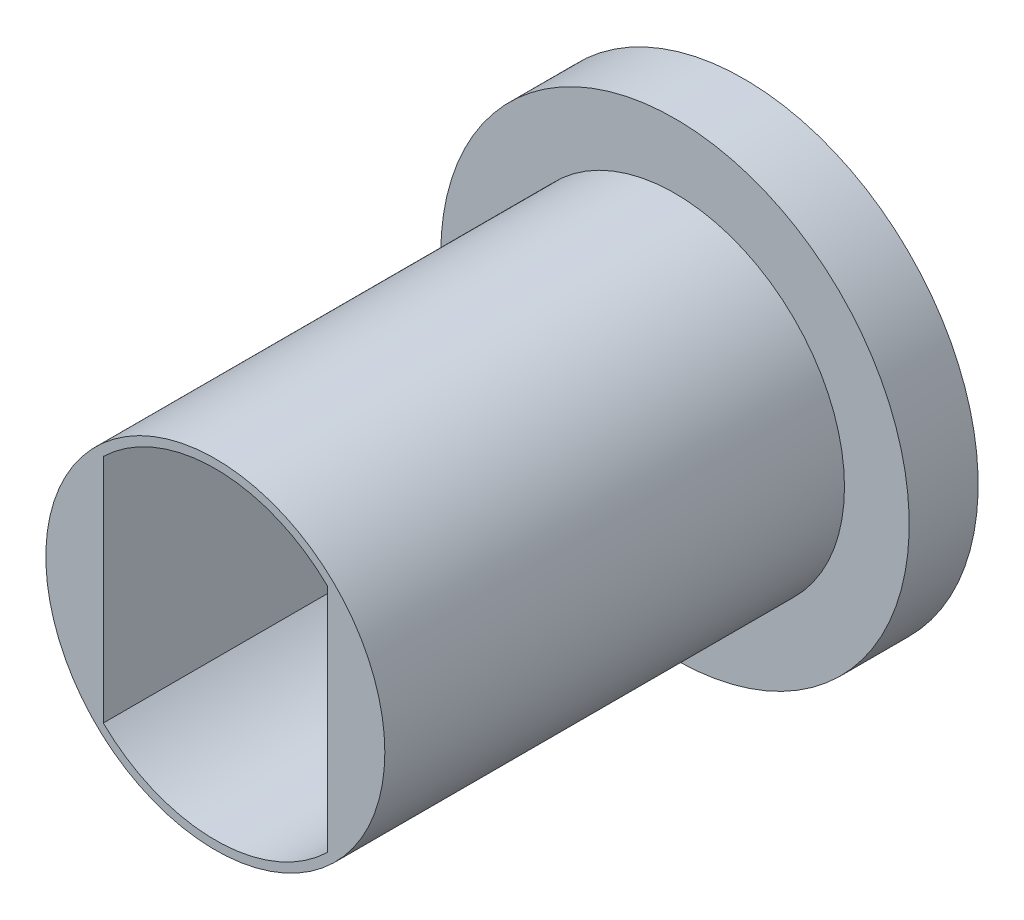
from build123d import *

# Parameters (mm, degrees)
ESBO_O2_R                = 2.95
RESSALTO_EXTRUS_O1_DEPTH = 8
ESBO_O3_R                = 4.076601305
ESBO_O3_R_2              = 1.475
RESSALTO_EXTRUS_O2_DEPTH = 1.2


with BuildPart() as part:
    # Esboço2 → Ressalto-extrusão1 (new body)
    with BuildSketch(Plane.XY):
        Circle(ESBO_O2_R)
        with BuildLine():
            Line((1.95, -2.00935313), (1.95, 2.00935313))
            ThreePointArc((1.95, 2.00935313), (0, 2.8), (-1.95, 2.00935313))
            Line((-1.95, 2.00935313), (-1.95, -2.00935313))
            ThreePointArc((-1.95, -2.00935313), (0, -2.8), (1.95, -2.00935313))
        make_face(mode=Mode.SUBTRACT)
    extrude(amount=RESSALTO_EXTRUS_O1_DEPTH)

    # Esboço3 → Ressalto-extrusão2 (add)
    with BuildSketch(Plane(origin=(0, 0, 0), x_dir=(-1, 0, 0), z_dir=(0, 0, -1))):
        Circle(ESBO_O3_R)
        Circle(ESBO_O3_R_2, mode=Mode.SUBTRACT)
    extrude(amount=RESSALTO_EXTRUS_O2_DEPTH)


solid = part.part
